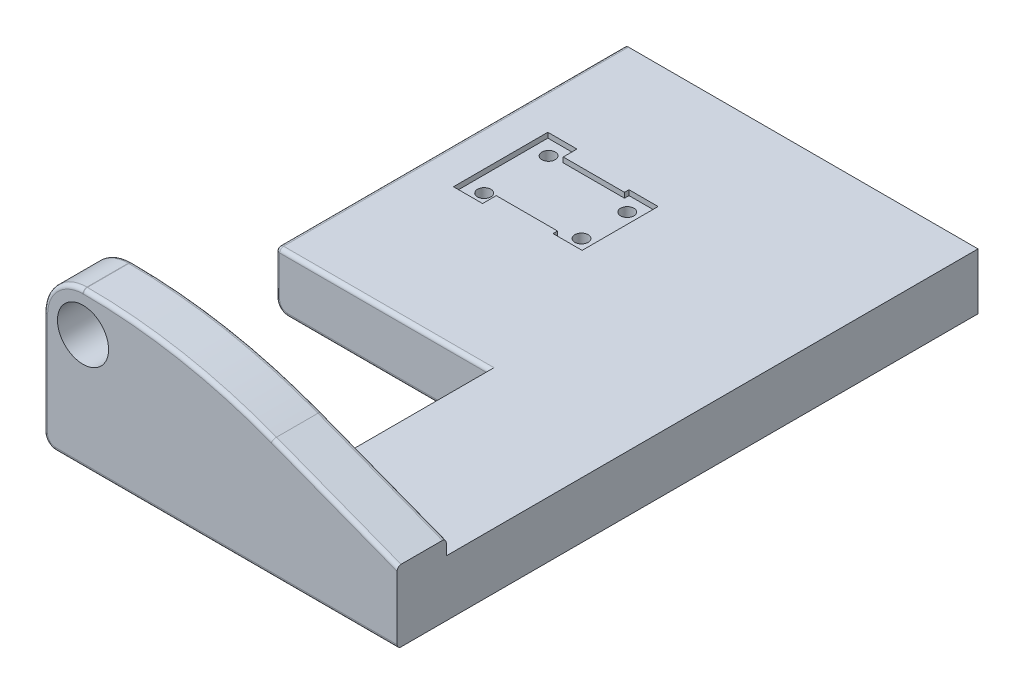
from build123d import *

# Parameters (mm, degrees)
BOSS_EXTRUDE1_DEPTH                             = 14.3
SKETCH2_R                                       = 1.5
CUT_EXTRUDE1_DEPTH                              = 1.3
CSK_FOR_M3_OVAL_HEAD_MACHINE_SCREW1_D           = 3.4
CSK_FOR_M3_OVAL_HEAD_MACHINE_SCREW1_CSINK_D     = 6.3
CSK_FOR_M3_OVAL_HEAD_MACHINE_SCREW1_CSINK_ANGLE = 90
BOSS_EXTRUDE2_START                             = -12.5
SKETCH8_R                                       = 6.5
BOSS_EXTRUDE2_DEPTH                             = 12.5
SKETCH14_W                                      = 40
SKETCH14_H                                      = 74
BOSS_EXTRUDE4_DEPTH                             = 25
CUT_EXTRUDE3_DEPTH                              = 4
M5_CLEARANCE_HOLE1_D                            = 5.5
FILLET1_R                                       = 4
FILLET1_OF_MIRROR3_R                            = 4
FILLET2_R                                       = 7
FILLET4_R                                       = 3
FILLET5_R                                       = 3
FILLET6_R                                       = 3
FILLET7_R                                       = 1
FILLET8_R                                       = 1
FILLET9_R                                       = 1
FILLET10_R                                      = 1
FILLET11_R                                      = 1
SKETCH21_W                                      = 13
SKETCH21_H                                      = 3.5
BOSS_EXTRUDE5_DEPTH                             = 33
CUT_EXTRUDE4_DEPTH                              = 17
CSK_FOR_M3_FLAT_HEAD_MACHINE_SCREW1_D           = 3.4
CSK_FOR_M3_FLAT_HEAD_MACHINE_SCREW1_CSINK_D     = 6.3
CSK_FOR_M3_FLAT_HEAD_MACHINE_SCREW1_CSINK_ANGLE = 90
CUT_EXTRUDE5_DEPTH                              = 434.079434689


with BuildPart() as part:
    # Sketch1 → Boss-Extrude1 (new body)
    with BuildSketch(Plane(origin=(0, 0, 0), x_dir=(1, 0, 0), z_dir=(0, 1, 0))):
        Polygon((27.724299065, -2.579662371), (27.724299065, 43.920337629), (-26.775700935, 43.920337629), (-26.775700935, 230.920337629), (27.724299065, 230.920337629), (27.724299065, 277.420337629), (-26.775700935, 277.420337629), (-26.775700935, 289.920337629), (318.224299065, 289.920337629), (318.224299065, -15.079662371), (-26.775700935, -15.079662371), (-26.775700935, -2.579662371), align=None)
    extrude(amount=BOSS_EXTRUDE1_DEPTH)

    # Sketch2 → Cut-Extrude1 (cut)
    # profile 1 of 2: a face of its own
    with BuildSketch(Plane(origin=(0, 14.3, 0), x_dir=(1, 0, 0), z_dir=(0, 1, 0))):
        Polygon((5.694299065, 191.745337629), (-9.875700935, 191.745337629), (-9.875700935, 195.230337629), (-17.275700935, 195.230337629), (-17.275700935, 171.230337629), (-9.875700935, 171.230337629), (-9.875700935, 174.715337629), (5.694299065, 174.715337629), (5.694299065, 173.570337629), (13.094299065, 173.570337629), (13.094299065, 192.890337629), (5.694299065, 192.890337629), align=None)
        with Locations(Location((-13.275700935, 191.420337629, 0), (0, 0, 270))):
            Circle(SKETCH2_R, mode=Mode.SUBTRACT)
        with Locations(Location((-13.275700935, 175.040337629, 0), (0, 0, 270))):
            Circle(SKETCH2_R, mode=Mode.SUBTRACT)
        with Locations(Location((9.094299065, 189.050337629, 0), (0, 0, 270))):
            Circle(SKETCH2_R, mode=Mode.SUBTRACT)
        with Locations(Location((9.094299065, 177.410337629, 0), (0, 0, 270))):
            Circle(SKETCH2_R, mode=Mode.SUBTRACT)
    # profile 2 of 2: a face of its own
    with BuildSketch(Plane(origin=(0, 14.3, 0), x_dir=(1, 0, 0), z_dir=(0, 1, 0))):
        Polygon((5.694299065, 100.125337629), (-9.875700935, 100.125337629), (-9.875700935, 103.610337629), (-17.275700935, 103.610337629), (-17.275700935, 79.610337629), (-9.875700935, 79.610337629), (-9.875700935, 83.095337629), (5.694299065, 83.095337629), (5.694299065, 81.950337629), (13.094299065, 81.950337629), (13.094299065, 101.270337629), (5.694299065, 101.270337629), align=None)
        with Locations(Location((-13.275700935, 99.800337629, 0), (0, 0, 270))):
            Circle(SKETCH2_R, mode=Mode.SUBTRACT)
        with Locations(Location((-13.275700935, 83.420337629, 0), (0, 0, 270))):
            Circle(SKETCH2_R, mode=Mode.SUBTRACT)
        with Locations(Location((9.094299065, 97.430337629, 0), (0, 0, 270))):
            Circle(SKETCH2_R, mode=Mode.SUBTRACT)
        with Locations(Location((9.094299065, 85.790337629, 0), (0, 0, 270))):
            Circle(SKETCH2_R, mode=Mode.SUBTRACT)
    extrude(amount=-CUT_EXTRUDE1_DEPTH, mode=Mode.SUBTRACT)

    # CSK for M3 Oval Head Machine Screw1 (through all)
    with Locations(Plane(origin=(0, 0, 0), x_dir=(-1, 0, 0), z_dir=(0, -1, 0))):
        with Locations((13.275700935, 191.420337629), (13.275700935, 175.040337629), (-9.094299065, 177.410337629), (-9.094299065, 189.050337629), (13.275700935, 83.420337629), (13.275700935, 99.800337629), (-9.094299065, 97.430337629), (-9.094299065, 85.790337629)):
            CounterSinkHole(CSK_FOR_M3_OVAL_HEAD_MACHINE_SCREW1_D / 2, CSK_FOR_M3_OVAL_HEAD_MACHINE_SCREW1_CSINK_D / 2, counter_sink_angle=CSK_FOR_M3_OVAL_HEAD_MACHINE_SCREW1_CSINK_ANGLE)

    # Sketch8 → Boss-Extrude2 (add)
    with BuildSketch(Plane.XY.offset(15.079662371).offset(BOSS_EXTRUDE2_START)):
        with BuildLine():
            Line((-26.775700935, 14.3), (73.224299065, 14.3))
            Line((73.224299065, 14.3), (31.446689864, 30.368311231))
            ThreePointArc((31.446689864, 30.368311231), (7.806182122, 37.048156923), (-16.656506763, 39.3))
            Line((-16.656506763, 39.3), (-16.775700935, 39.3))
            ThreePointArc((-16.775700935, 39.3), (-23.846768746, 36.371067812), (-26.775700935, 29.3))
            Line((-26.775700935, 29.3), (-26.775700935, 14.3))
        make_face()
        with Locations((-16.775700935, 29.3)):
            Circle(SKETCH8_R, mode=Mode.SUBTRACT)
    extrude(amount=BOSS_EXTRUDE2_DEPTH)

    # Mirror1: part across plane


with BuildPart() as part_1:
    add(part.part)
    add(part.part.mirror(Plane.XY.offset(-137.420337629)))

    # Sketch14 → Boss-Extrude4 (add)
    with BuildSketch(Plane(origin=(0, 14.3, 0), x_dir=(1, 0, 0), z_dir=(0, 1, 0))):
        with Locations((298.224299065, 21.920337629)):
            Rectangle(SKETCH14_W, SKETCH14_H)
    boss_extrude4 = extrude(amount=BOSS_EXTRUDE4_DEPTH)

    # Sketch15 → Cut-Extrude3 (cut)
    with BuildSketch(Plane(origin=(318.224299065, 0, 0), x_dir=(0, 0, -1), z_dir=(1, 0, 0))):
        Polygon((1.920337629, 24.103847577), (6.420337629, 26.701923789), (6.420337629, 31.898076211), (1.920337629, 34.496152423), (-2.579662371, 31.898076211), (-2.579662371, 26.701923789), align=None)
        Polygon((41.920337629, 24.103847577), (46.420337629, 26.701923789), (46.420337629, 31.898076211), (41.920337629, 34.496152423), (37.420337629, 31.898076211), (37.420337629, 26.701923789), align=None)
    cut_extrude3 = extrude(amount=-CUT_EXTRUDE3_DEPTH, mode=Mode.SUBTRACT)

    # M5 Clearance Hole1 (through all)
    with Locations(Plane(origin=(314.224299065, 0, 0), x_dir=(0, 0, -1), z_dir=(1, 0, 0))):
        with Locations((1.920337629, 29.3), (41.920337629, 29.3)):
            m5_clearance_hole1 = Hole(M5_CLEARANCE_HOLE1_D / 2)

    # Fillet1
    fillet1_edges = [part_1.edges().sort_by_distance(p)[0] for p in [
        (278.224299065, 39.3, -21.920337629),
    ]]
    fillet(fillet1_edges, radius=FILLET1_R)

    # Mirror3: Boss-Extrude4, Cut-Extrude3, M5 Clearance Hole1 across plane
    add(boss_extrude4.mirror(Plane.XY.offset(-137.420337629)))
    add(cut_extrude3.mirror(Plane.XY.offset(-137.420337629)), mode=Mode.SUBTRACT)
    add(m5_clearance_hole1.mirror(Plane.XY.offset(-137.420337629)), mode=Mode.SUBTRACT)

    # Fillet1 of Mirror3
    fillet1_of_mirror3_edges = [part_1.edges().sort_by_distance(p)[0] for p in [
        (278.224299065, 39.3, -252.920337629),
    ]]
    fillet(fillet1_of_mirror3_edges, radius=FILLET1_OF_MIRROR3_R)

    # Fillet2
    fillet2_edges = [part_1.edges().sort_by_distance(p)[0] for p in [
        (318.224299065, 0, -137.420337629),
    ]]
    fillet(fillet2_edges, radius=FILLET2_R)

    # Fillet4
    fillet4_edges = [part_1.edges().sort_by_distance(p)[0] for p in [
        (-26.775700935, 0, -137.420337629),
    ]]
    fillet(fillet4_edges, radius=FILLET4_R)

    # Fillet5
    fillet5_edges = [part_1.edges().sort_by_distance(p)[0] for p in [
        (-26.775700935, 0, 8.829662371),
    ]]
    fillet(fillet5_edges, radius=FILLET5_R)

    # Fillet6
    fillet6_edges = [part_1.edges().sort_by_distance(p)[0] for p in [
        (-26.775700935, 0, -283.670337629),
    ]]
    fillet(fillet6_edges, radius=FILLET6_R)

    # Fillet7
    fillet7_edges = [part_1.edges().sort_by_distance(p)[0] for p in [
        (52.335494465, 22.334155616, 15.079662371),
        (7.806182122, 37.048156923, 15.079662371),
        (-16.716103849, 39.3, 15.079662371),
        (-23.846768746, 36.371067812, 15.079662371),
        (318.224299065, 23.15, 15.079662371),
        (-26.775700935, 16.15, 15.079662371),
        (316.174046534, 2.050252532, 15.079662371),
        (143.724299065, 0, 15.079662371),
        (-25.897021278, 0.878679656, 15.079662371),
    ]]
    fillet(fillet7_edges, radius=FILLET7_R)

    # Fillet8
    fillet8_edges = [part_1.edges().sort_by_distance(p)[0] for p in [
        (-26.775700935, 16.15, -289.920337629),
        (318.224299065, 23.15, -289.920337629),
        (-23.846768746, 36.371067812, -289.920337629),
        (-16.716103849, 39.3, -289.920337629),
        (7.806182122, 37.048156923, -289.920337629),
        (52.335494465, 22.334155616, -289.920337629),
        (143.724299065, 0, -289.920337629),
        (316.174046534, 2.050252532, -289.920337629),
        (-25.897021278, 0.878679656, -289.920337629),
    ]]
    fillet(fillet8_edges, radius=FILLET8_R)

    # Fillet9
    fillet9_edges = [part_1.edges().sort_by_distance(p)[0] for p in [
        (27.724299065, 0, -20.670337629),
        (1.974299065, 0, 2.579662371),
        (-26.775700935, 8.65, -43.920337629),
        (-23.846768746, 36.371067812, 2.579662371),
        (-16.716103849, 39.3, 2.579662371),
        (7.806182122, 37.048156923, 2.579662371),
        (52.335494465, 22.334155616, 2.579662371),
        (-26.775700935, 16.15, 2.579662371),
        (1.974299065, 0, -43.920337629),
        (-25.897021278, 0.878679656, -43.920337629),
        (-25.897021278, 0.878679656, 2.579662371),
    ]]
    fillet(fillet9_edges, radius=FILLET9_R)

    # Fillet10
    fillet10_edges = [part_1.edges().sort_by_distance(p)[0] for p in [
        (1.974299065, 0, -230.920337629),
        (27.724299065, 0, -254.170337629),
        (-26.775700935, 8.65, -230.920337629),
        (-26.775700935, 16.15, -277.420337629),
        (52.335494465, 22.334155616, -277.420337629),
        (7.806182122, 37.048156923, -277.420337629),
        (-16.716103849, 39.3, -277.420337629),
        (-23.846768746, 36.371067812, -277.420337629),
        (-25.897021278, 0.878679656, -230.920337629),
        (1.974299065, 0, -277.420337629),
        (-25.897021278, 0.878679656, -277.420337629),
    ]]
    fillet(fillet10_edges, radius=FILLET10_R)

    # Fillet11
    fillet11_edges = [part_1.edges().sort_by_distance(p)[0] for p in [
        (0.974299065, 14.3, -230.920337629),
        (0.974299065, 14.3, -43.920337629),
        (-26.482807716, 14.3, -44.213230848),
        (-26.775700935, 14.3, -137.420337629),
        (-26.482807716, 14.3, -230.62744441),
    ]]
    fillet(fillet11_edges, radius=FILLET11_R)

    # Sketch21 → Boss-Extrude5 (add)
    with BuildSketch(Plane(origin=(0, 14.3, 0), x_dir=(1, 0, 0), z_dir=(0, 1, 0))):
        with Locations((215.599299065, 13.170337629)):
            Rectangle(SKETCH21_W, SKETCH21_H)
        with Locations((215.599299065, 26.670337629)):
            Rectangle(SKETCH21_W, SKETCH21_H)
    boss_extrude5 = extrude(amount=BOSS_EXTRUDE5_DEPTH)

    # Sketch22 → Cut-Extrude4 (cut)
    with BuildSketch(Plane.XY.offset(-11.420337629)):
        with BuildLine():
            Line((209.099299065, 41.3), (209.099299065, 47.3))
            Line((209.099299065, 47.3), (215.599299065, 49.081376358))
            Line((215.599299065, 49.081376358), (222.099299065, 47.3))
            Line((222.099299065, 47.3), (222.099299065, 41.3))
            ThreePointArc((222.099299065, 41.3), (215.599299065, 47.3), (209.099299065, 41.3))
        make_face()
    cut_extrude4 = extrude(amount=-CUT_EXTRUDE4_DEPTH, mode=Mode.SUBTRACT)

    # CSK for M3 Flat Head Machine Screw1 (through all)
    with Locations(Plane.XY.offset(-11.420337629)):
        with Locations((215.594856714, 41.29339707), (185.090080481, 50.471650395), (10.649939144, 122.619059121)):
            csk_for_m3_flat_head_machine_screw1 = CounterSinkHole(CSK_FOR_M3_FLAT_HEAD_MACHINE_SCREW1_D / 2, CSK_FOR_M3_FLAT_HEAD_MACHINE_SCREW1_CSINK_D / 2, counter_sink_angle=CSK_FOR_M3_FLAT_HEAD_MACHINE_SCREW1_CSINK_ANGLE)

    # Mirror4: Boss-Extrude5, Cut-Extrude4, CSK for M3 Flat Head Machine Screw1 across plane
    add(boss_extrude5.mirror(Plane.XY.offset(-137.420337629)))
    add(cut_extrude4.mirror(Plane.XY.offset(-137.420337629)), mode=Mode.SUBTRACT)
    add(csk_for_m3_flat_head_machine_screw1.mirror(Plane.XY.offset(-137.420337629)), mode=Mode.SUBTRACT)

    # only_engine_part → Cut-Extrude5 (cut, through all)
    with BuildSketch(Plane.XZ):
        Polygon((-26.775700935, -289.920337629), (318.224299065, -289.920337629), (318.224299065, 15.079662371), (63.094299065, 15.079662371), (63.094299065, -132.610337629), (-26.775700935, -132.610337629), align=None)
    extrude(amount=-CUT_EXTRUDE5_DEPTH, mode=Mode.SUBTRACT)


solid = part_1.part
